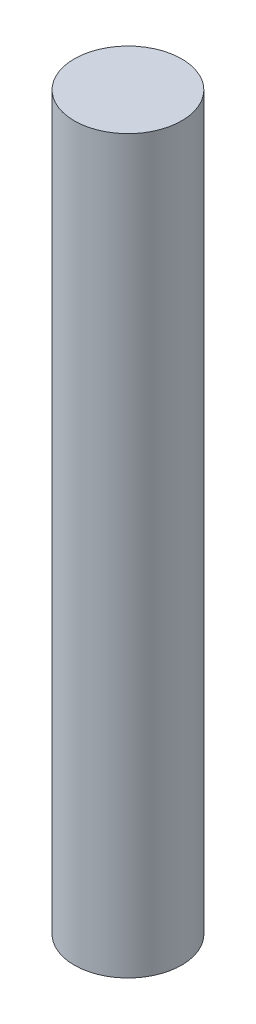
from build123d import *

# Parameters (mm, degrees)
SKETCH1_R           = 1.27
BOSS_EXTRUDE1_DEPTH = 17.2974


with BuildPart() as part:
    # Sketch1 → Boss-Extrude1 (new body)
    with BuildSketch(Plane(origin=(0, 0, 0), x_dir=(1, 0, 0), z_dir=(0, 1, 0))):
        with Locations(Location((0, 0, 0), (0, 0, 270))):
            Circle(SKETCH1_R)
    extrude(amount=BOSS_EXTRUDE1_DEPTH)


solid = part.part
